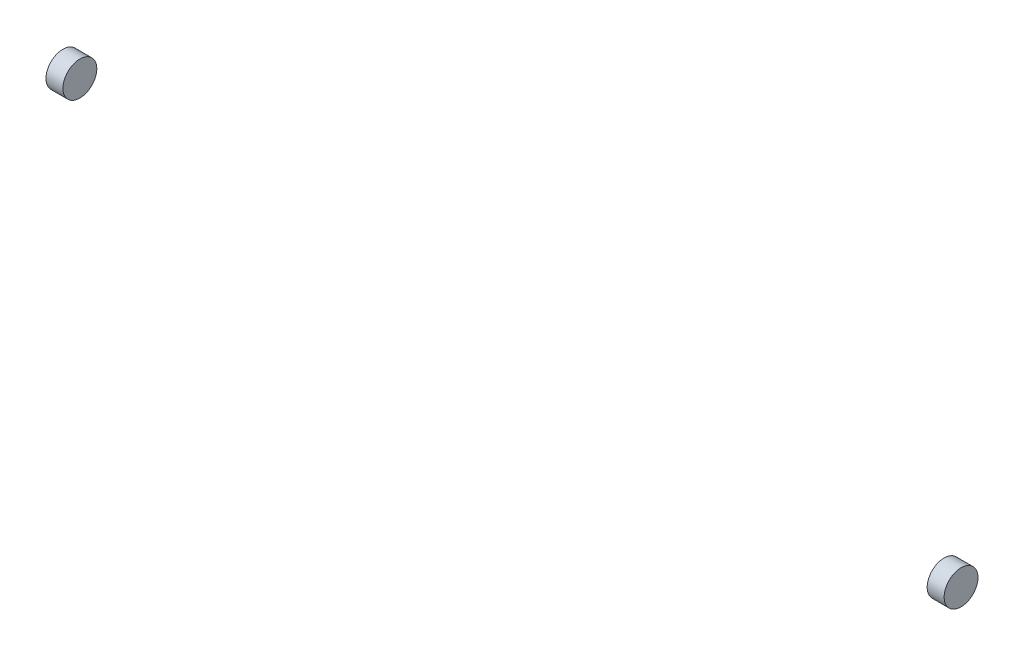
from build123d import *

# Parameters (mm, degrees)
BOSS_EXTRUDE1_START = -3180
SKETCH1_R           = 120
BOSS_EXTRUDE1_DEPTH = 120
BOSS_EXTRUDE2_START = 3060
SKETCH2_R           = 120
BOSS_EXTRUDE2_DEPTH = 120


with BuildPart() as part:
    # Sketch1 → Boss-Extrude1 (new body)
    with BuildSketch(Plane(origin=(0, 0, 0), x_dir=(0, 0, -1), z_dir=(1, 0, 0)).offset(BOSS_EXTRUDE1_START)):
        with Locations((0, -80)):
            Circle(SKETCH1_R)
    extrude(amount=BOSS_EXTRUDE1_DEPTH)


with BuildPart() as body_2:
    # Sketch2 → Boss-Extrude2 (new body)
    with BuildSketch(Plane(origin=(0, 0, 0), x_dir=(0, 0, -1), z_dir=(1, 0, 0)).offset(BOSS_EXTRUDE2_START)):
        with Locations((0, -80)):
            Circle(SKETCH2_R)
    extrude(amount=BOSS_EXTRUDE2_DEPTH)


solid = Compound([part.part, body_2.part])
